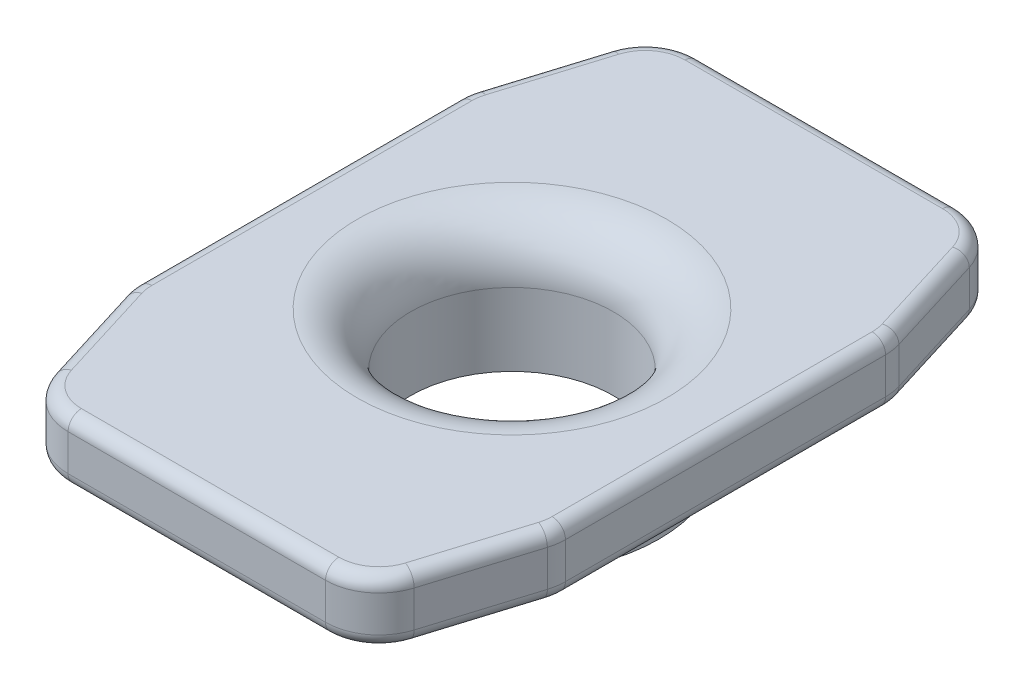
from build123d import *

# Parameters (mm, degrees)
SKETCH1_R           = 2.413
BOSS_EXTRUDE1_DEPTH = 1.5
BOSS_EXTRUDE2_START = 1.5
SKETCH2_R           = 3.5
SKETCH2_R_2         = 2.413
BOSS_EXTRUDE2_DEPTH = 1.5
FILLET1_R           = 1.27
FILLET2_R           = 0.3175


with BuildPart() as part:
    # Sketch1 → Boss-Extrude1 (new body)
    with BuildSketch(Plane(origin=(0, 0, 0), x_dir=(1, 0, 0), z_dir=(0, 1, 0))):
        Polygon((4, 7.5), (-4, 7.5), (-5.08, 4), (-5.08, -4), (-4, -7.5), (4, -7.5), (5.08, -4), (5.08, 4), align=None)
        with Locations(Location((0, 0, 0), (0, 0, 270))):
            Circle(SKETCH1_R, mode=Mode.SUBTRACT)
    extrude(amount=BOSS_EXTRUDE1_DEPTH)

    # Sketch2 → Boss-Extrude2 (add)
    with BuildSketch(Plane.XZ.offset(BOSS_EXTRUDE2_START)):
        with Locations(Location((0, 0, 0), (0, 0, 90))):
            Circle(SKETCH2_R)
        with Locations(Location((0, 0, 0), (0, 0, 90))):
            Circle(SKETCH2_R_2, mode=Mode.SUBTRACT)
    extrude(amount=-BOSS_EXTRUDE2_DEPTH)

    # Fillet1
    fillet1_edges = [part.edges().sort_by_distance(p)[0] for p in [
        (-5.08, 0.75, 4),
        (-5.08, 0.75, -4),
        (-4, 0.75, -7.5),
        (4, 0.75, -7.5),
        (5.08, 0.75, -4),
        (5.08, 0.75, 4),
        (4, 0.75, 7.5),
        (-4, 0.75, 7.5),
        (0, 1.5, -2.413),
    ]]
    fillet(fillet1_edges, radius=FILLET1_R)

    # Fillet2
    fillet2_edges = [part.edges().sort_by_distance(p)[0] for p in [
        (0, 0, -3.5),
        (-4.64993803, 1.5, 5.393719347),
        (0, 1.5, 7.5),
        (4.64993803, 1.5, 5.393719347),
        (5.08, 1.5, 0),
        (4.64993803, 1.5, -5.393719347),
        (0, 1.5, -7.5),
        (-4.64993803, 1.5, -5.393719347),
        (-5.08, 1.5, 0),
        (5.065805445, 1.5, 3.997859771),
        (5.065805445, 1.5, -3.997859771),
        (3.816897156, 1.5, -7.251877837),
        (-3.816897156, 1.5, -7.251877837),
        (-5.065805445, 1.5, -3.997859771),
        (-5.065805445, 1.5, 3.997859771),
        (-3.816897156, 1.5, 7.251877837),
        (3.816897156, 1.5, 7.251877837),
        (4.64993803, 0, 5.393719347),
        (-4.64993803, 0, 5.393719347),
        (-5.08, 0, 0),
        (-4.64993803, 0, -5.393719347),
        (0, 0, -7.5),
        (4.64993803, 0, -5.393719347),
        (5.08, 0, 0),
        (0, 0, 7.5),
        (5.065805445, 0, 3.997859771),
        (5.065805445, 0, -3.997859771),
        (3.816897156, 0, -7.251877837),
        (-3.816897156, 0, -7.251877837),
        (-5.065805445, 0, -3.997859771),
        (-5.065805445, 0, 3.997859771),
        (-3.816897156, 0, 7.251877837),
        (3.816897156, 0, 7.251877837),
    ]]
    fillet(fillet2_edges, radius=FILLET2_R)


solid = part.part
